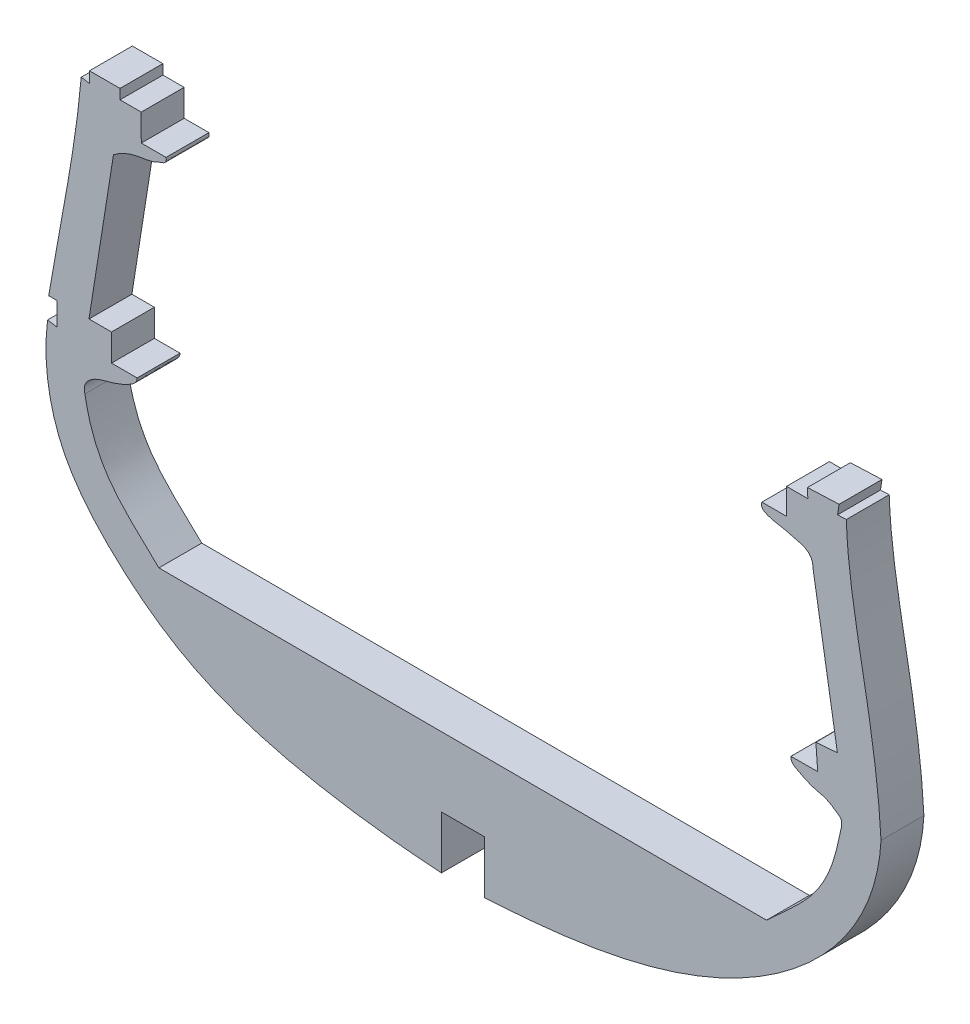
from build123d import *

# Parameters (mm, degrees)
EXTRUDE_1_DEPTH = 8


with BuildPart() as part:
    # 草图1 → 凸台-拉伸1 (new body)
    with BuildSketch(Plane.XY):
        with BuildLine():
            Line((1400.603760099, 978.416369467), (1400.599392251, 988.263589195))
            Line((1400.599392251, 988.263589195), (1392.599712444, 988.263589195))
            Line((1392.599712444, 988.263589195), (1392.604079587, 978.417959503))
            add(Edge.make_bspline(
                [(1392.604079587, 978.417959503), (1384.30166337, 978.94733203), (1368.912777657, 980.70514512), (1347.037181685, 986.748020488), (1331.779283503, 998.008038547), (1319.839099854, 1012.229243702), (1318.288469561, 1024.341828932), (1319.135260859, 1031.004616696)],
                knots=[0, 0, 0, 0, 0.246033273, 0.460162014, 0.662188525, 0.799060766, 1, 1, 1, 1], degree=3))
            Line((1319.135260859, 1031.004616696), (1320.907243326, 1030.723962245))
            Line((1320.907243326, 1030.723962245), (1320.905341678, 1035.011187846))
            Line((1320.905341678, 1035.011187846), (1319.343435038, 1035.010495045))
            add(Edge.make_bspline(
                [(1319.343435038, 1035.010495045), (1321.434217291, 1047.780189011), (1324.298149422, 1060.432120676), (1325.415824413, 1073.350052662)],
                knots=[0, 0, 0, 0, 1, 1, 1, 1], degree=3))
            Line((1325.415824413, 1073.350052662), (1326.948986358, 1073.107223666))
            Line((1326.948986358, 1073.107223666), (1326.948079648, 1075.15138308))
            Line((1326.948079648, 1075.15138308), (1332.645915356, 1075.153910421))
            Line((1332.645915356, 1075.153910421), (1332.646735241, 1073.305497823))
            Line((1332.646735241, 1073.305497823), (1336.608040968, 1073.307254906))
            Line((1336.608040968, 1073.307254906), (1336.610260651, 1068.303028573))
            Line((1336.610260651, 1068.303028573), (1341.234650632, 1068.305079775))
            add(Edge.make_bspline(
                [(1341.234650632, 1068.305079775), (1341.484178537, 1067.240633889), (1340.286932477, 1067.107503445), (1339.002085334, 1066.41807256), (1337.47574421, 1066.046809065), (1334.726067539, 1065.751837387), (1332.596211567, 1064.738407546), (1331.425389742, 1063.822646585)],
                knots=[0, 0, 0, 0, 0.192766917, 0.2634426, 0.393742259, 0.603766483, 1, 1, 1, 1], degree=3))
            Line((1331.425389742, 1063.822646585), (1326.863118242, 1035.017597998))
            Line((1326.863118242, 1035.017597998), (1331.057954718, 1035.019458666))
            Line((1331.057954718, 1035.019458666), (1331.060187748, 1029.98514055))
            Line((1331.060187748, 1029.98514055), (1335.841257782, 1029.987261249))
            add(Edge.make_bspline(
                [(1335.841257782, 1029.987261249), (1335.823974875, 1029.113659646), (1333.934198394, 1027.840601132), (1331.095949112, 1026.764483365), (1327.508531347, 1026.008669295), (1325.609173799, 1024.074891704), (1326.102260107, 1022.533431935)],
                knots=[0, 0, 0, 0, 0.176554534, 0.474168244, 0.69551046, 1, 1, 1, 1], degree=3))
            add(Edge.make_bspline(
                [(1326.102260107, 1022.533431935), (1326.688090473, 1019.028661059), (1329.404776613, 1010.537208741), (1336.322738402, 1004.78156047), (1339.895283128, 1001.334985628)],
                knots=[0, 0, 0, 0, 0.415295232, 1, 1, 1, 1], degree=3))
            Line((1339.895283128, 1001.334985628), (1453.225525149, 1001.098930774))
            add(Edge.make_bspline(
                [(1453.225525149, 1001.098930774), (1456.41603516, 1004.195864104), (1461.770461312, 1008.228877627), (1465.772288531, 1016.352191438), (1466.675656416, 1020.771584156), (1467.46190007, 1024.283519039), (1465.732138964, 1025.517545827), (1464.649363752, 1026.209847157), (1463.563673383, 1026.491705662)],
                knots=[0, 0, 0, 0, 0.417472858, 0.611309404, 0.814395293, 0.872955231, 0.899659972, 1, 1, 1, 1], degree=3))
            add(Edge.make_bspline(
                [(1457.777895082, 1029.841463334), (1457.691538568, 1028.935335948), (1459.955886804, 1027.688543829), (1461.813917023, 1026.82312411), (1463.563673383, 1026.491705662)],
                knots=[0, 0, 0, 0, 0.320094329, 1, 1, 1, 1], degree=3))
            Line((1457.777895082, 1029.841463334), (1462.770085624, 1029.865645917))
            Line((1462.770085624, 1029.865645917), (1462.424250556, 1034.438915705))
            Line((1462.424250556, 1034.438915705), (1466.446301553, 1034.743067077))
            Line((1466.446301553, 1034.743067077), (1461.889510036, 1062.322541758))
            add(Edge.make_bspline(
                [(1452.362068525, 1068.191018948), (1452.063228547, 1067.291975571), (1453.550572586, 1066.39583292), (1456.001193688, 1066.067628013), (1459.255253794, 1065.245091068), (1461.850162915, 1064.537133592), (1461.889510036, 1062.322541758)],
                knots=[0, 0, 0, 0, 0.17200161, 0.374139345, 0.617870859, 1, 1, 1, 1], degree=3))
            Line((1452.362068525, 1068.191018948), (1456.951436219, 1068.193054615))
            Line((1456.951436219, 1068.193054615), (1456.949291773, 1073.027663064))
            Line((1456.949291773, 1073.027663064), (1460.92901528, 1073.029428317))
            Line((1460.92901528, 1073.029428317), (1460.855963084, 1074.796919448))
            Line((1460.855963084, 1074.796919448), (1466.760060369, 1075.040941762))
            Line((1466.760060369, 1075.040941762), (1466.466334548, 1073.186429915))
            Line((1466.466334548, 1073.186429915), (1468.109322459, 1073.254336267))
            add(Edge.make_bspline(
                [(1474.577797045, 1024.67595534), (1474.179758571, 1032.396128039), (1471.709505065, 1048.571943007), (1468.377527701, 1064.603635783), (1468.109322459, 1073.254336267)],
                knots=[0, 0, 0, 0, 0.472460007, 1, 1, 1, 1], degree=3))
            add(Edge.make_bspline(
                [(1400.603760099, 978.416369467), (1415.963129029, 979.277774), (1447.942432473, 983.227856531), (1473.641534196, 1007.502754347), (1474.577797045, 1024.67595534)],
                knots=[0, 0, 0, 0, 0.489063486, 1, 1, 1, 1], degree=3))
        make_face()
    extrude(amount=EXTRUDE_1_DEPTH)


solid = part.part
